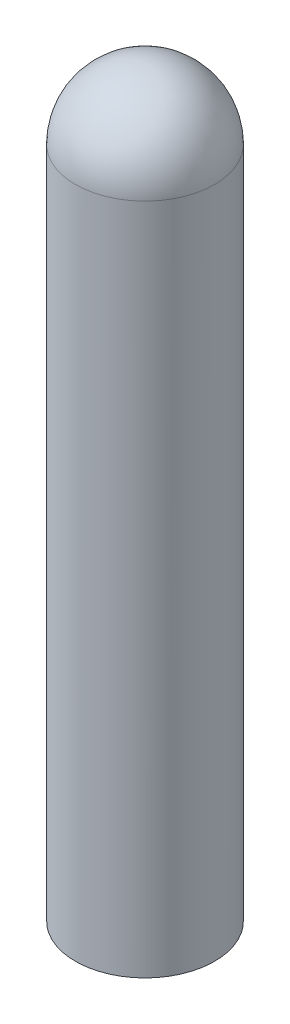
from build123d import *


with BuildPart() as part:
    # Esquisse2 → Base-Révolution (revolve)
    with BuildSketch(Plane.XY, mode=Mode.PRIVATE) as base_r_volution_sk:
        with BuildLine():
            Line((0, -10), (0, 41))
            ThreePointArc((0, 41), (2.588190451, 40.659258263), (5, 39.660254038))
            Line((5, 39.660254038), (5, -8.660254038))
            ThreePointArc((5, -8.660254038), (2.588190451, -9.659258263), (0, -10))
        make_face()
    revolve(base_r_volution_sk.sketch.rotate(Axis((0, -10, 0), (0, 1, 0)), 90), axis=Axis((0, -10, 0), (0, 1, 0)))

    # Esquisse3 → Révolution1 (revolve)
    with BuildSketch(Plane.XY):
        with BuildLine():
            Line((0, 34.660254038), (0, 44.660254038))
            ThreePointArc((0, 44.660254038), (5, 39.660254038), (0, 34.660254038))
        make_face()
    revolve(axis=Axis((0, -10, 0), (0, 1, 0)))


solid = part.part
